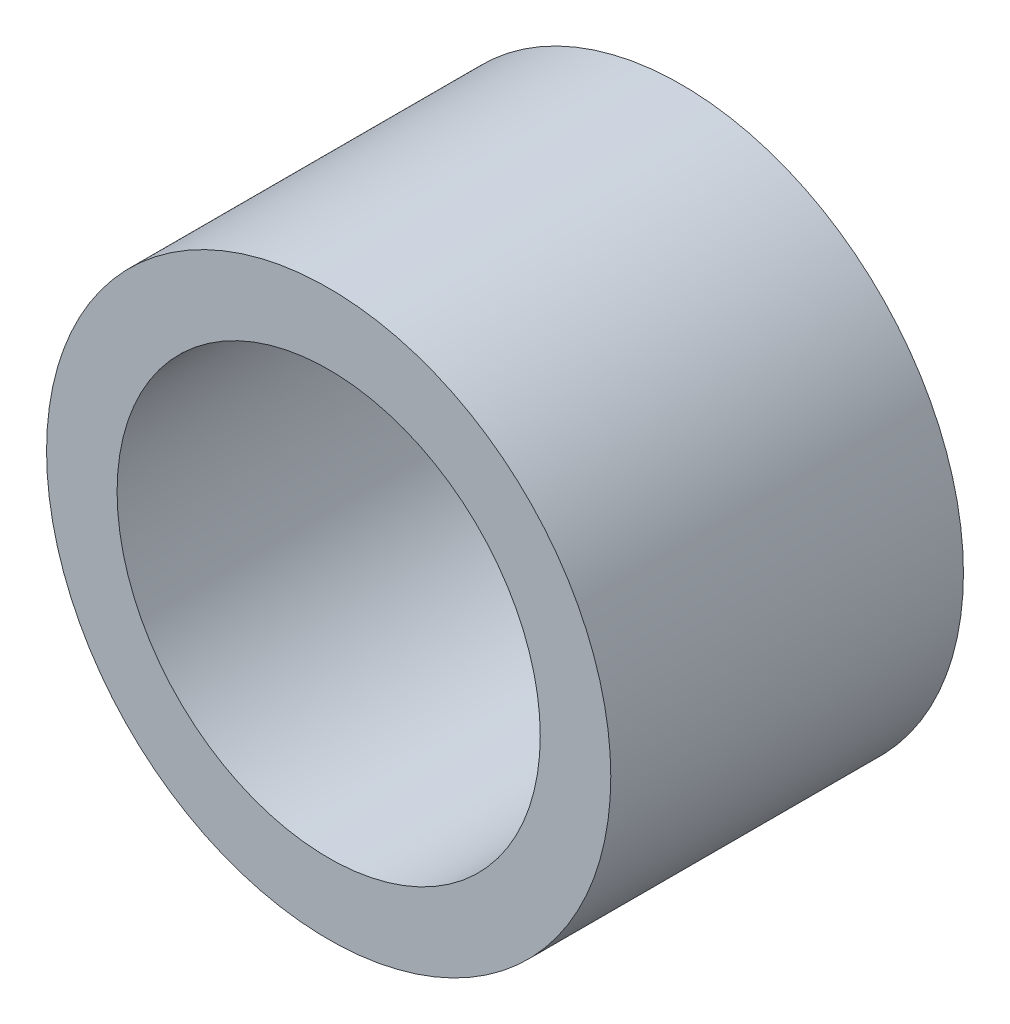
from build123d import *

# Parameters (mm, degrees)
SKETCH_1_R      = 4
SKETCH_1_R_2    = 3
EXTRUDE_1_DEPTH = 5
SKETCH_1_2_R    = 4
SKETCH_1_2_R_2  = 3
EXTRUDE_2_DEPTH = 5


with BuildPart() as part:
    # 草图1 → 凸台-拉伸1 (new body)
    with BuildSketch(Plane.XY):
        Circle(SKETCH_1_R)
        Circle(SKETCH_1_R_2, mode=Mode.SUBTRACT)
    extrude(amount=EXTRUDE_1_DEPTH)

    # 草图1<2> → 凸台-拉伸2 (add)
    with BuildSketch(Plane.XY):
        Circle(SKETCH_1_2_R)
        Circle(SKETCH_1_2_R_2, mode=Mode.SUBTRACT)
    extrude(amount=EXTRUDE_2_DEPTH)


solid = part.part
